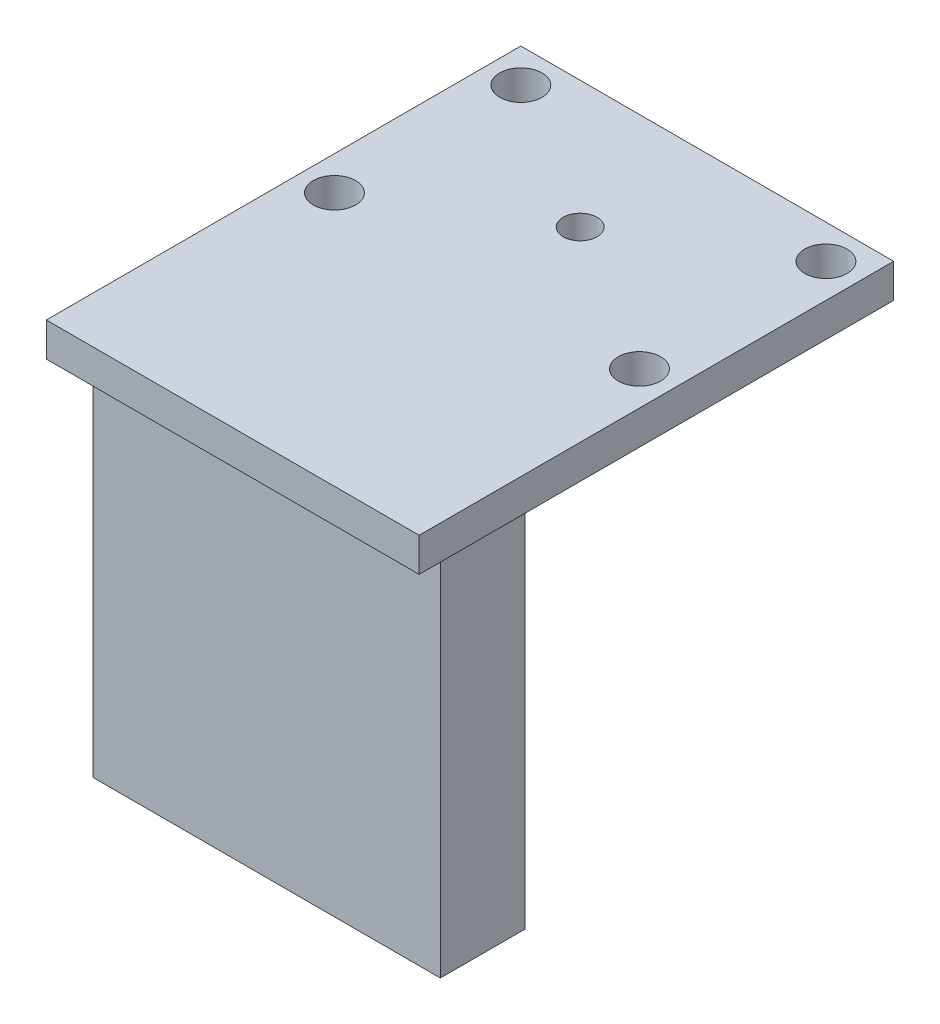
from build123d import *

# Parameters (mm, degrees)
SKETCH_1_W                      = 22
SKETCH_1_H                      = 28
EXTRUDE_1_DEPTH                 = 2
CUT_EXTRUDE_1_REACH             = 19.916
SKETCH_2_R                      = 1.25
SKETCH_3_W                      = 20.5
SKETCH_3_H                      = 5
EXTRUDE_2_DEPTH                 = 22
CUT_EXTRUDE_2_REACH             = 31.883
SKETCH_4_R                      = 1
CUT_EXTRUDE_2_DIRECTION_2_DEPTH = 30.883105595


with BuildPart() as part:
    # 草图1 → 凸台-拉伸1 (new body)
    with BuildSketch(Plane(origin=(0, 0, 0), x_dir=(1, 0, 0), z_dir=(0, 1, 0))):
        Rectangle(SKETCH_1_W, SKETCH_1_H)
    extrude(amount=EXTRUDE_1_DEPTH)

    # 草图2 → 切除-拉伸1 (cut, up to next)
    with BuildSketch(Plane(origin=(0, 2, 0), x_dir=(1, 0, 0), z_dir=(0, 1, 0)), mode=Mode.PRIVATE) as cut_extrude_1_sk1:
        with Locations(Location((9, 12, 0), (0, 0, 270))):
            Circle(SKETCH_2_R)
    cut_extrude_1_tool1 = extrude(cut_extrude_1_sk1.sketch, amount=-CUT_EXTRUDE_1_REACH, mode=Mode.PRIVATE) & part.part
    # 草图2 → 切除-拉伸1 (cut, up to next)
    with BuildSketch(Plane(origin=(0, 2, 0), x_dir=(1, 0, 0), z_dir=(0, 1, 0)), mode=Mode.PRIVATE) as cut_extrude_1_sk2:
        with Locations(Location((-9, 12, 0), (0, 0, 90))):
            Circle(SKETCH_2_R)
    cut_extrude_1_tool2 = extrude(cut_extrude_1_sk2.sketch, amount=-CUT_EXTRUDE_1_REACH, mode=Mode.PRIVATE) & part.part
    # 草图2 → 切除-拉伸1 (cut, up to next)
    with BuildSketch(Plane(origin=(0, 2, 0), x_dir=(1, 0, 0), z_dir=(0, 1, 0)), mode=Mode.PRIVATE) as cut_extrude_1_sk3:
        with Locations(Location((-9, 1, 0), (0, 0, 90))):
            Circle(SKETCH_2_R)
    cut_extrude_1_tool3 = extrude(cut_extrude_1_sk3.sketch, amount=-CUT_EXTRUDE_1_REACH, mode=Mode.PRIVATE) & part.part
    # 草图2 → 切除-拉伸1 (cut, up to next)
    with BuildSketch(Plane(origin=(0, 2, 0), x_dir=(1, 0, 0), z_dir=(0, 1, 0)), mode=Mode.PRIVATE) as cut_extrude_1_sk4:
        with Locations(Location((9, 1, 0), (0, 0, 270))):
            Circle(SKETCH_2_R)
    cut_extrude_1_tool4 = extrude(cut_extrude_1_sk4.sketch, amount=-CUT_EXTRUDE_1_REACH, mode=Mode.PRIVATE) & part.part
    add(cut_extrude_1_tool1.solids().sort_by_distance((9, 2, -12))[0], mode=Mode.SUBTRACT)
    add(cut_extrude_1_tool2.solids().sort_by_distance((-9, 2, -12))[0], mode=Mode.SUBTRACT)
    add(cut_extrude_1_tool3.solids().sort_by_distance((-9, 2, -1))[0], mode=Mode.SUBTRACT)
    add(cut_extrude_1_tool4.solids().sort_by_distance((9, 2, -1))[0], mode=Mode.SUBTRACT)

    # 草图3 → 凸台-拉伸2 (add)
    with BuildSketch(Plane.XZ):
        with Locations((0, 9.5)):
            Rectangle(SKETCH_3_W, SKETCH_3_H)
    extrude(amount=EXTRUDE_2_DEPTH)

    # 草图4 → 切除-拉伸2 (cut, up to next)
    with BuildSketch(Plane(origin=(0, 2, 0), x_dir=(1, 0, 0), z_dir=(0, 1, 0)), mode=Mode.PRIVATE) as cut_extrude_2_sk1:
        with Locations(Location((0, 6.5, 0), (0, 0, 90))):
            Circle(SKETCH_4_R)
    cut_extrude_2_tool1 = extrude(cut_extrude_2_sk1.sketch, amount=-CUT_EXTRUDE_2_REACH, mode=Mode.PRIVATE) & part.part
    add(cut_extrude_2_tool1.solids().sort_by_distance((0, 2, -6.5))[0], mode=Mode.SUBTRACT)

    # 草图4 → 切除-拉伸2 direction 2 (cut)
    with BuildSketch(Plane(origin=(0, 2, 0), x_dir=(1, 0, 0), z_dir=(0, 1, 0))):
        with Locations(Location((0, 6.5, 0), (0, 0, 90))):
            Circle(SKETCH_4_R)
    extrude(amount=CUT_EXTRUDE_2_DIRECTION_2_DEPTH, mode=Mode.SUBTRACT)


solid = part.part
